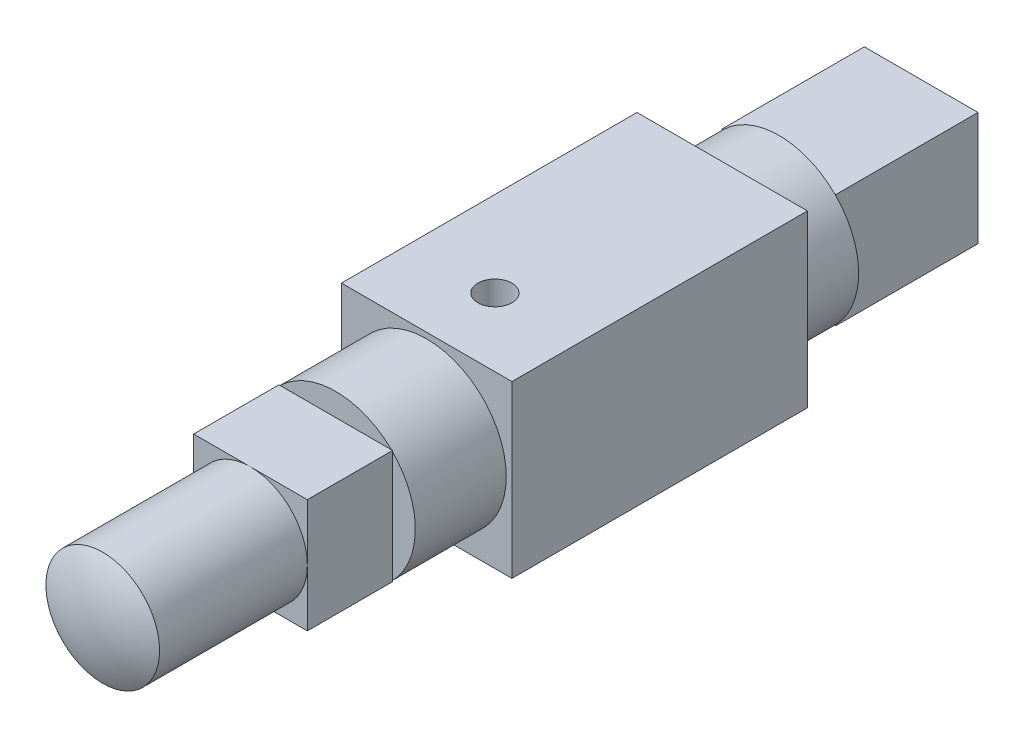
from build123d import *

# Parameters (mm, degrees)
SKETCH1_W           = 15
SKETCH1_H           = 15
BOSS_EXTRUDE1_DEPTH = 26
SKETCH2_R           = 1.5
CUT_EXTRUDE1_DEPTH  = 31.939457009
SKETCH3_R           = 7
BOSS_EXTRUDE2_DEPTH = 8
SKETCH4_W           = 10
SKETCH4_H           = 10
BOSS_EXTRUDE3_DEPTH = 7.5
SKETCH5_R           = 5
BOSS_EXTRUDE4_DEPTH = 13
BOSS_EXTRUDE5_START = 5
SKETCH7_R           = 7
BOSS_EXTRUDE5_DEPTH = 5
SKETCH8_W           = 10
SKETCH8_H           = 10
BOSS_EXTRUDE6_DEPTH = 12.5


with BuildPart() as part:
    # Sketch1 → Boss-Extrude1 (new body)
    with BuildSketch(Plane.XY):
        Rectangle(SKETCH1_W, SKETCH1_H)
    extrude(amount=BOSS_EXTRUDE1_DEPTH)

    # Sketch2 → Cut-Extrude1 (cut, through all)
    with BuildSketch(Plane(origin=(0, 7.5, 0), x_dir=(1, 0, 0), z_dir=(0, 1, 0))):
        with Locations(Location((0, -20, 0), (0, 0, 270))):
            Circle(SKETCH2_R)
    extrude(amount=-CUT_EXTRUDE1_DEPTH, mode=Mode.SUBTRACT)

    # Sketch3 → Boss-Extrude2 (add)
    with BuildSketch(Plane.XY.offset(26)):
        Circle(SKETCH3_R)
    extrude(amount=BOSS_EXTRUDE2_DEPTH)

    # Sketch4 → Boss-Extrude3 (add)
    with BuildSketch(Plane.XY.offset(34)):
        Rectangle(SKETCH4_W, SKETCH4_H)
    extrude(amount=BOSS_EXTRUDE3_DEPTH)

    # Sketch5 → Boss-Extrude4 (add)
    with BuildSketch(Plane.XY.offset(41.5)):
        Circle(SKETCH5_R)
    extrude(amount=BOSS_EXTRUDE4_DEPTH)

    # Sketch6 → Revolve1 (revolve)
    with BuildSketch(Plane(origin=(0, 0, 0), x_dir=(1, 0, 0), z_dir=(0, 1, 0)), mode=Mode.PRIVATE) as revolve1_sk:
        with BuildLine():
            Line((0, -54.5), (5, -54.5))
            ThreePointArc((5, -54.5), (2.582569334, -55.466460537), (0, -55.795630141))
            Line((0, -55.795630141), (0, -54.5))
        make_face()
    revolve(revolve1_sk.sketch.rotate(Axis((0, 0, 54.5), (0, 0, 1)), 224.415308597), axis=Axis((0, 0, 54.5), (0, 0, 1)))

    # Sketch7 → Boss-Extrude5 (add)
    with BuildSketch(Plane(origin=(0, 0, 0), x_dir=(-1, 0, 0), z_dir=(0, 0, -1)).offset(BOSS_EXTRUDE5_START)):
        with Locations(Location((0, 0, 0), (0, 0, 315.584691403))):
            Circle(SKETCH7_R)
    extrude(amount=-BOSS_EXTRUDE5_DEPTH)

    # Sketch8 → Boss-Extrude6 (add)
    with BuildSketch(Plane(origin=(0, 0, -5), x_dir=(-1, 0, 0), z_dir=(0, 0, -1))):
        Rectangle(SKETCH8_W, SKETCH8_H)
    extrude(amount=BOSS_EXTRUDE6_DEPTH)


solid = part.part
